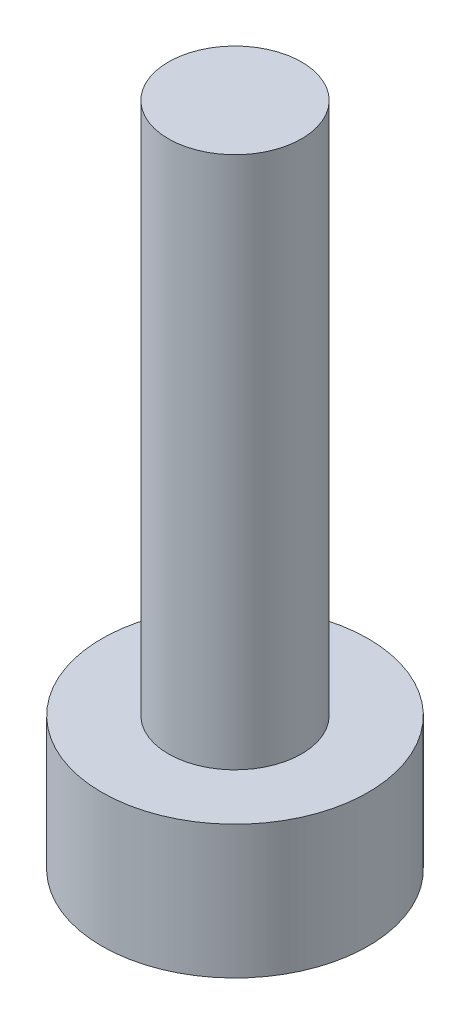
from build123d import *

# Parameters (mm, degrees)
SKETCH1_R           = 3
BOSS_EXTRUDE1_DEPTH = 3
SKETCH2_R           = 1.5
BOSS_EXTRUDE2_DEPTH = 12


with BuildPart() as part:
    # Sketch1 → Boss-Extrude1 (new body)
    with BuildSketch(Plane(origin=(0, 0, 0), x_dir=(1, 0, 0), z_dir=(0, 1, 0))):
        with Locations(Location((0, 0, 0), (0, 0, 270))):
            Circle(SKETCH1_R)
    extrude(amount=BOSS_EXTRUDE1_DEPTH)

    # Sketch2 → Boss-Extrude2 (add)
    with BuildSketch(Plane(origin=(0, 3, 0), x_dir=(1, 0, 0), z_dir=(0, 1, 0))):
        with Locations(Location((0, 0, 0), (0, 0, 270))):
            Circle(SKETCH2_R)
    extrude(amount=BOSS_EXTRUDE2_DEPTH)


solid = part.part
